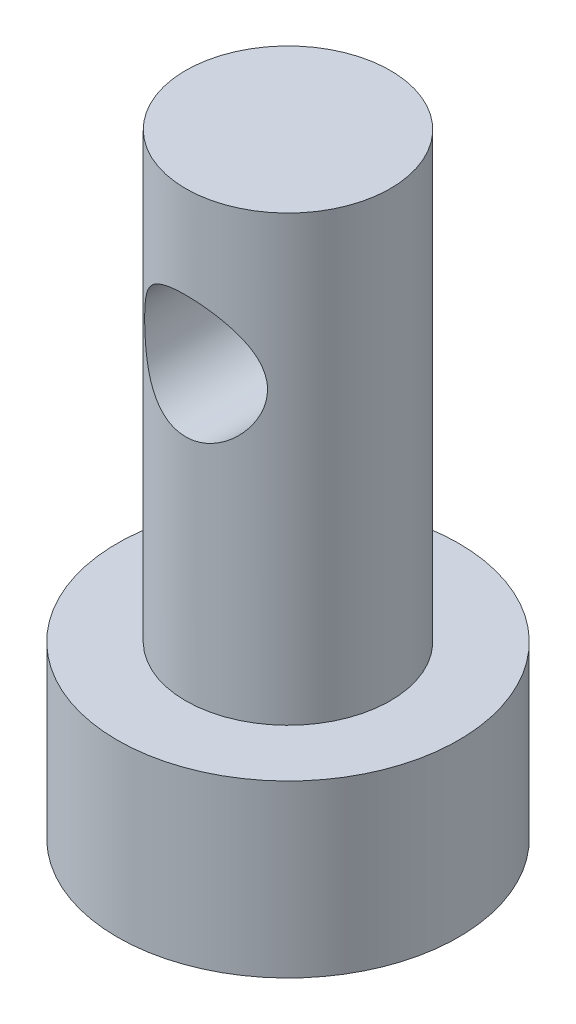
from build123d import *

# Parameters (mm, degrees)
SKETCH1_R               = 5
BOSS_EXTRUDE1_DEPTH     = 5
SKETCH2_R               = 3
BOSS_EXTRUDE2_DEPTH     = 13
SKETCH3_R               = 1.9
CUT_EXTRUDE1_DEPTH      = 10
CUT_EXTRUDE5_DEPTH      = 20.339079606
CUT_EXTRUDE5_DEPTH_BACK = 0.4
SKETCH7_R               = 1.8


with BuildPart() as part:
    # Sketch1 → Boss-Extrude1 (new body)
    with BuildSketch(Plane(origin=(0, 0, 0), x_dir=(1, 0, 0), z_dir=(0, 1, 0))):
        Circle(SKETCH1_R)
    extrude(amount=BOSS_EXTRUDE1_DEPTH)

    # Sketch2 → Boss-Extrude2 (add)
    with BuildSketch(Plane(origin=(0, 5, 0), x_dir=(1, 0, 0), z_dir=(0, 1, 0))):
        Circle(SKETCH2_R)
    extrude(amount=BOSS_EXTRUDE2_DEPTH)

    # Sketch3 → Cut-Extrude1 (cut)
    with BuildSketch(Plane.XZ):
        Circle(SKETCH3_R)
    extrude(amount=-CUT_EXTRUDE1_DEPTH, mode=Mode.SUBTRACT)

    # Sketch7 → Cut-Extrude5 (cut, two sides: drawn at the far end of the back side and taken through both)
    with BuildSketch(Plane.XY.offset(-CUT_EXTRUDE5_DEPTH_BACK)):
        with Locations((0, 13.5)):
            Circle(SKETCH7_R)
    extrude(amount=CUT_EXTRUDE5_DEPTH + CUT_EXTRUDE5_DEPTH_BACK, mode=Mode.SUBTRACT)


solid = part.part
